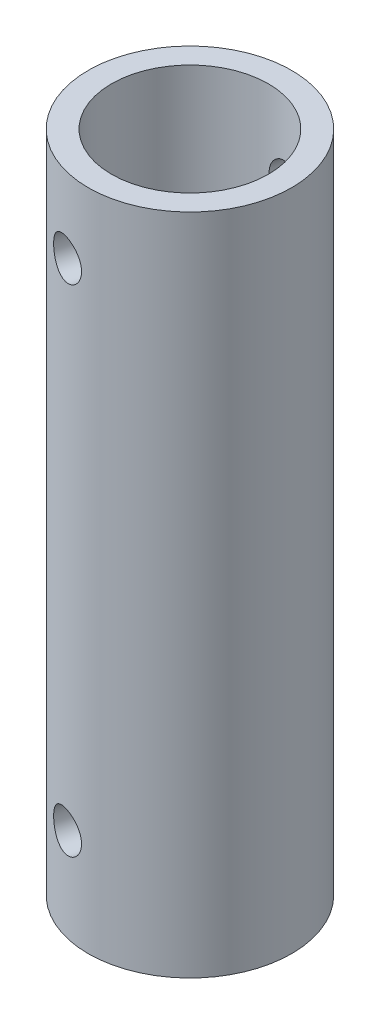
from build123d import *

# Parameters (mm, degrees)
SKETCH2_R               = 13.335
SKETCH2_R_2             = 10.287
BOSS_EXTRUDE2_DEPTH     = 87
CUT_EXTRUDE1_DEPTH      = 20
CUT_EXTRUDE1_DEPTH_BACK = 20
SKETCH4_R               = 2.6


with BuildPart() as part:
    # Sketch2 → Boss-Extrude2 (new body)
    with BuildSketch(Plane(origin=(0, 0, 0), x_dir=(1, 0, 0), z_dir=(0, 1, 0))):
        Circle(SKETCH2_R)
        Circle(SKETCH2_R_2, mode=Mode.SUBTRACT)
    extrude(amount=BOSS_EXTRUDE2_DEPTH)

    # Sketch4 → Cut-Extrude1 (cut, two sides: drawn at the far end of the back side and taken through both)
    with BuildSketch(Plane(origin=(-1275.101492903, -824.70990816, -345.604288183), x_dir=(-0.965175873824897, 0, -0.2616018589122535), z_dir=(0.2616018589122535, 2.2232920799531116e-15, -0.965175873824897)).offset(-CUT_EXTRUDE1_DEPTH_BACK)):
        with Locations((-1321.107921864, 901.70990816)):
            Circle(SKETCH4_R)
        with Locations((-1321.107921864, 836.70990816)):
            Circle(SKETCH4_R)
    extrude(amount=CUT_EXTRUDE1_DEPTH + CUT_EXTRUDE1_DEPTH_BACK, mode=Mode.SUBTRACT)


solid = part.part
